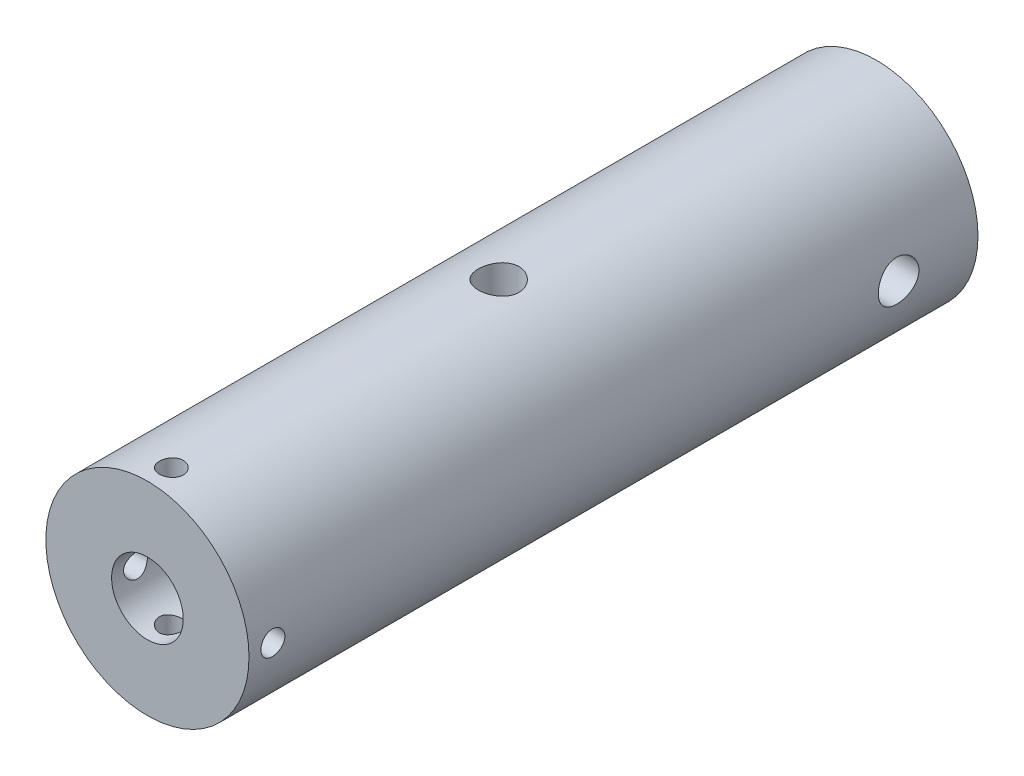
from build123d import *

# Parameters (mm, degrees)
SKETCH1_R           = 8.5
BOSS_EXTRUDE1_DEPTH = 61
SKETCH9_R           = 1.7
CUT_EXTRUDE2_DEPTH  = 6.7
SKETCH10_R          = 1
CUT_EXTRUDE3_DEPTH  = 8.7
CIRPATTERN1_COUNT   = 4
SKETCH11_R          = 1.7
CUT_EXTRUDE4_DEPTH  = 8.7


with BuildPart() as part:
    # Sketch1 → Boss-Extrude1 (new body)
    with BuildSketch(Plane.XY):
        with Locations(Location((0, 0, 0), (0, 0, 180))):
            Circle(SKETCH1_R)
    extrude(amount=BOSS_EXTRUDE1_DEPTH)

    # Sketch7 → Cut-Revolve1 (revolve, cut)
    with BuildSketch(Plane(origin=(0, 0, 0), x_dir=(0, 0, -1), z_dir=(1, 0, 0)), mode=Mode.PRIVATE) as cut_revolve1_sk:
        Polygon((-61, 3), (-5, 3), (-1, 1.5), (0, 1.5), (0, 0), (-61, 0), align=None)
    revolve(cut_revolve1_sk.sketch.rotate(Axis((0, 0, 0), (0, 0, 1)), 90), axis=Axis((0, 0, 0), (0, 0, 1)), mode=Mode.SUBTRACT)

    # Sketch9 → Cut-Extrude2 (cut)
    with BuildSketch(Plane(origin=(8.5, 0, 0), x_dir=(0, 0, -1), z_dir=(1, 0, 0))):
        with Locations((-6.641615966, 0)):
            Circle(SKETCH9_R)
    extrude(amount=-CUT_EXTRUDE2_DEPTH, mode=Mode.SUBTRACT)

    # Sketch10 → Cut-Extrude3 (cut)
    with BuildSketch(Plane(origin=(0, 0, 0), x_dir=(0, 0, -1), z_dir=(1, 0, 0))):
        with Locations(Location((-59, 0, 0), (0, 0, 180))):
            Circle(SKETCH10_R)
    cut_extrude3 = extrude(amount=-CUT_EXTRUDE3_DEPTH, mode=Mode.SUBTRACT)

    # CirPattern1: Cut-Extrude3 ×4 about axis
    cirpattern1_axis = Axis((0, 0, 61), (0, 0, 1))
    for i in range(1, CIRPATTERN1_COUNT):
        add(cut_extrude3.rotate(cirpattern1_axis, i * 360 / CIRPATTERN1_COUNT), mode=Mode.SUBTRACT)

    # Sketch11 → Cut-Extrude4 (cut)
    with BuildSketch(Plane(origin=(0, 8.5, 0), x_dir=(1, 0, 0), z_dir=(0, 1, 0))):
        with Locations(Location((0, -31.611405642, 0), (0, 0, 270))):
            Circle(SKETCH11_R)
    extrude(amount=-CUT_EXTRUDE4_DEPTH, mode=Mode.SUBTRACT)


solid = part.part
